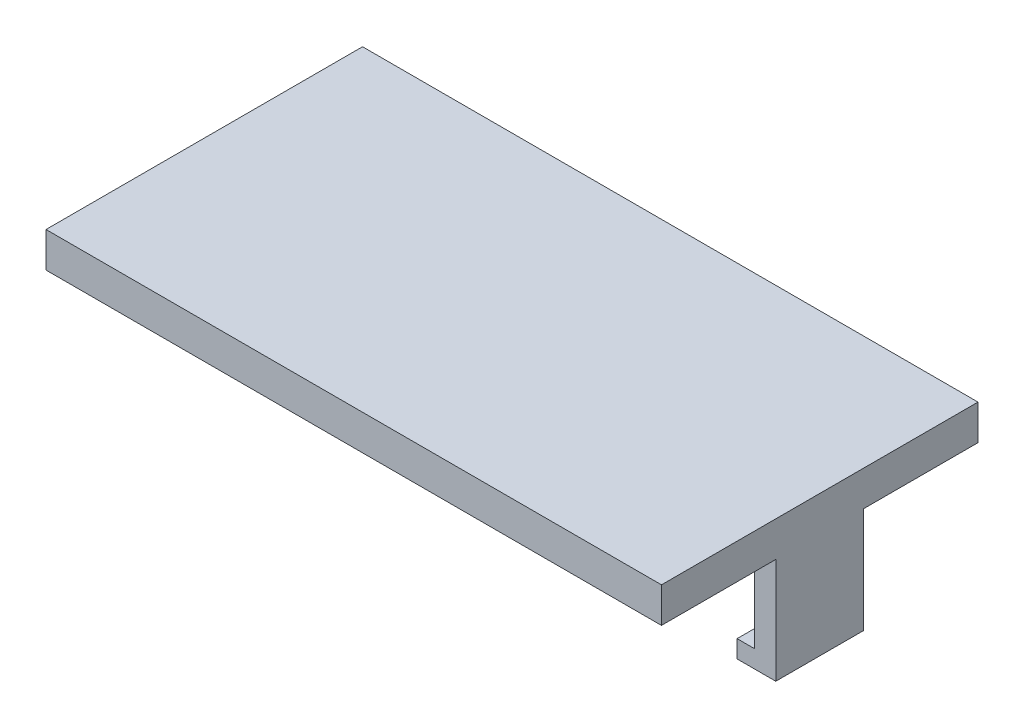
from build123d import *

# Parameters (mm, degrees)
SKETCH1_W           = 35
SKETCH1_H           = 18
BOSS_EXTRUDE1_DEPTH = 2
SKETCH2_W           = 5
SKETCH2_H           = 6
BOSS_EXTRUDE2_DEPTH = 1.2
SKETCH3_W           = 5
SKETCH3_H           = 1
BOSS_EXTRUDE3_DEPTH = 1


with BuildPart() as part:
    # Sketch1 → Boss-Extrude1 (new body)
    with BuildSketch(Plane(origin=(0, 0, 0), x_dir=(1, 0, 0), z_dir=(0, 1, 0))):
        Rectangle(SKETCH1_W, SKETCH1_H)
    extrude(amount=BOSS_EXTRUDE1_DEPTH)

    # Sketch2 → Boss-Extrude2 (add)
    with BuildSketch(Plane(origin=(17.5, 0, 0), x_dir=(0, 0, -1), z_dir=(1, 0, 0))):
        with Locations((0, -3)):
            Rectangle(SKETCH2_W, SKETCH2_H)
    boss_extrude2 = extrude(amount=-BOSS_EXTRUDE2_DEPTH)

    # Sketch3 → Boss-Extrude3 (add)
    with BuildSketch(Plane.ZY.offset(-16.3)):
        with Locations((0, -5.5)):
            Rectangle(SKETCH3_W, SKETCH3_H)
    boss_extrude3 = extrude(amount=BOSS_EXTRUDE3_DEPTH)

    # Mirror1: Boss-Extrude2, Boss-Extrude3 across plane
    add(boss_extrude2.mirror(Plane(origin=(0, 0, 0), x_dir=(0, 0, 1), z_dir=(1, 0, 0))))
    add(boss_extrude3.mirror(Plane(origin=(0, 0, 0), x_dir=(0, 0, 1), z_dir=(1, 0, 0))))


solid = part.part
